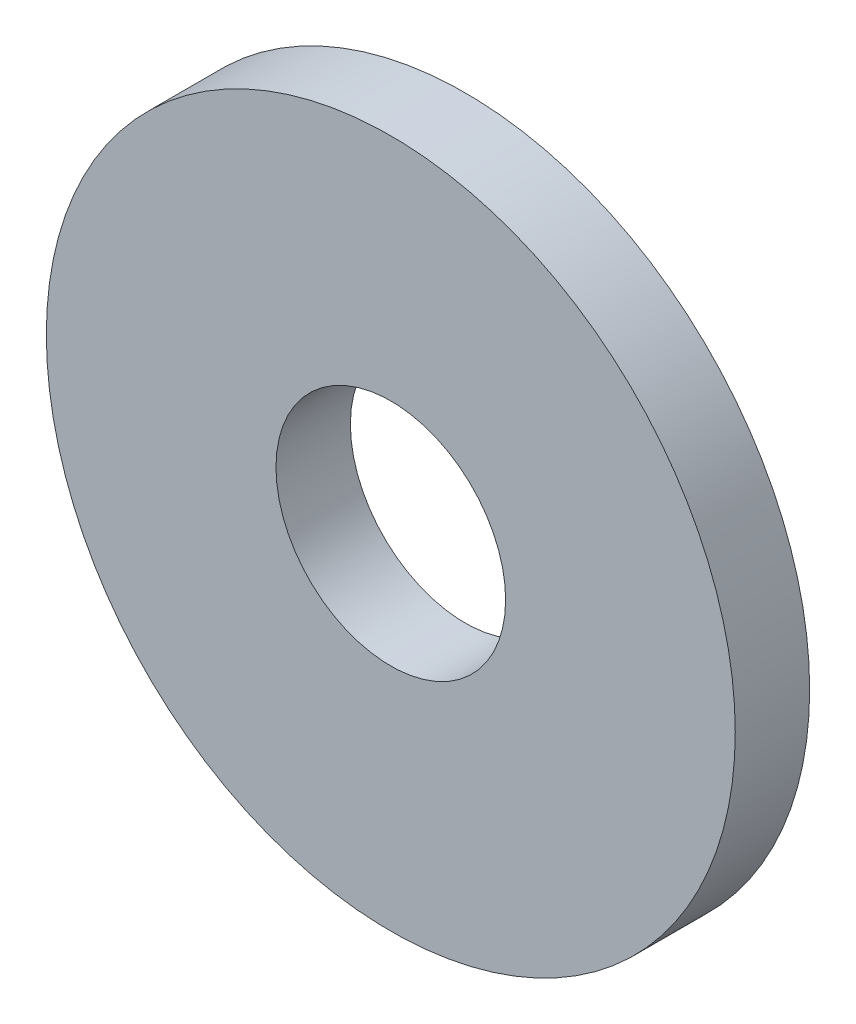
from build123d import *

# Parameters (mm, degrees)
SKETCH3_R           = 4.7625
SKETCH3_R_2         = 1.5875
BOSS_EXTRUDE1_DEPTH = 0.51435


with BuildPart() as part:
    # Sketch3 → Boss-Extrude1 (new, symmetric)
    with BuildSketch(Plane.XY):
        Circle(SKETCH3_R)
        Circle(SKETCH3_R_2, mode=Mode.SUBTRACT)
    extrude(amount=BOSS_EXTRUDE1_DEPTH, both=True)


solid = part.part
